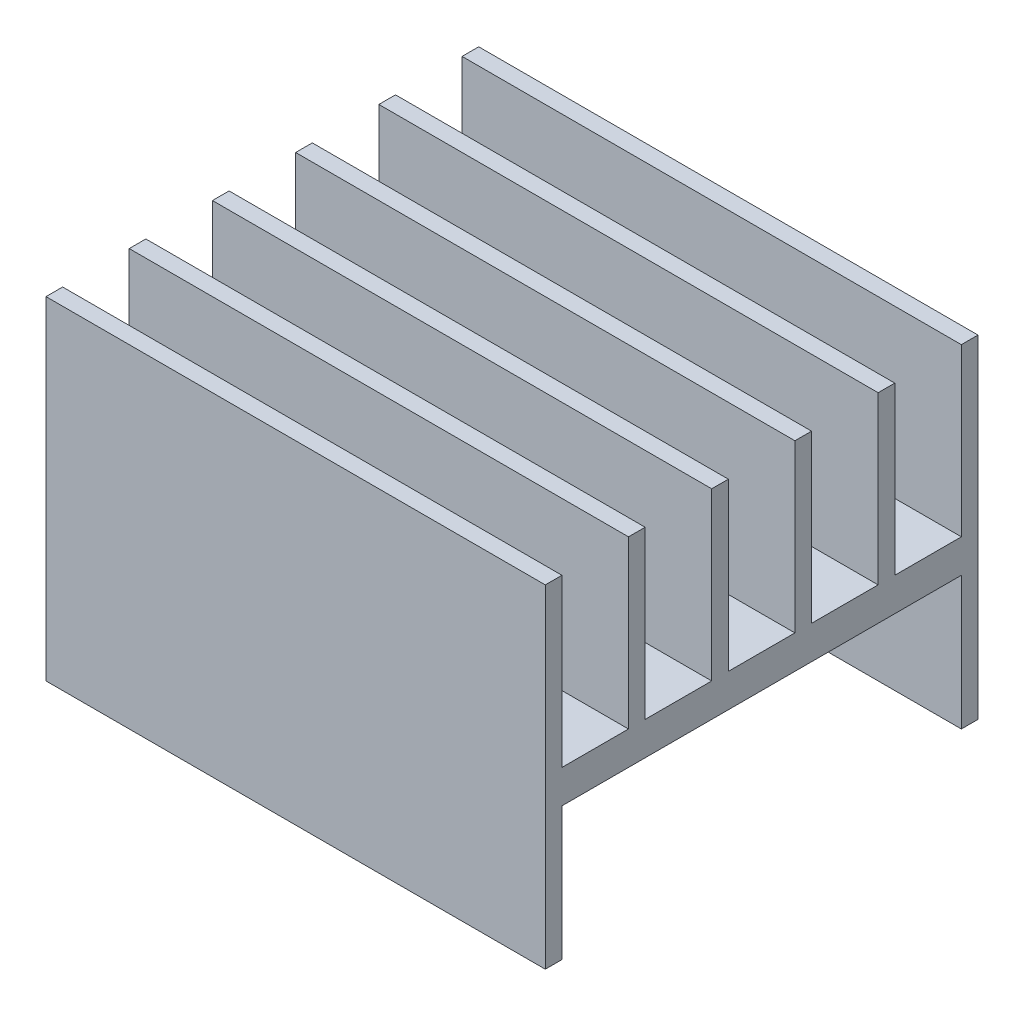
from build123d import *

# Parameters (mm, degrees)
EXTRUDE_1_DEPTH = 30


with BuildPart() as part:
    # 草图1 → 凸台-拉伸1 (new body)
    with BuildSketch(Plane(origin=(0, 0, 0), x_dir=(0, 0, -1), z_dir=(1, 0, 0))):
        Polygon((2, 0), (-2, 0), (-2, 10), (-3, 10), (-3, 0), (-7, 0), (-7, 10), (-8, 10), (-8, 0), (-12, 0), (-12, 10), (-13, 10), (-13, -10), (-12, -10), (-12, -2), (12, -2), (12, -10), (13, -10), (13, 10), (12, 10), (12, 0), (8, 0), (8, 10), (7, 10), (7, 0), (3, 0), (3, 10), (2, 10), align=None)
    extrude(amount=EXTRUDE_1_DEPTH)


solid = part.part
